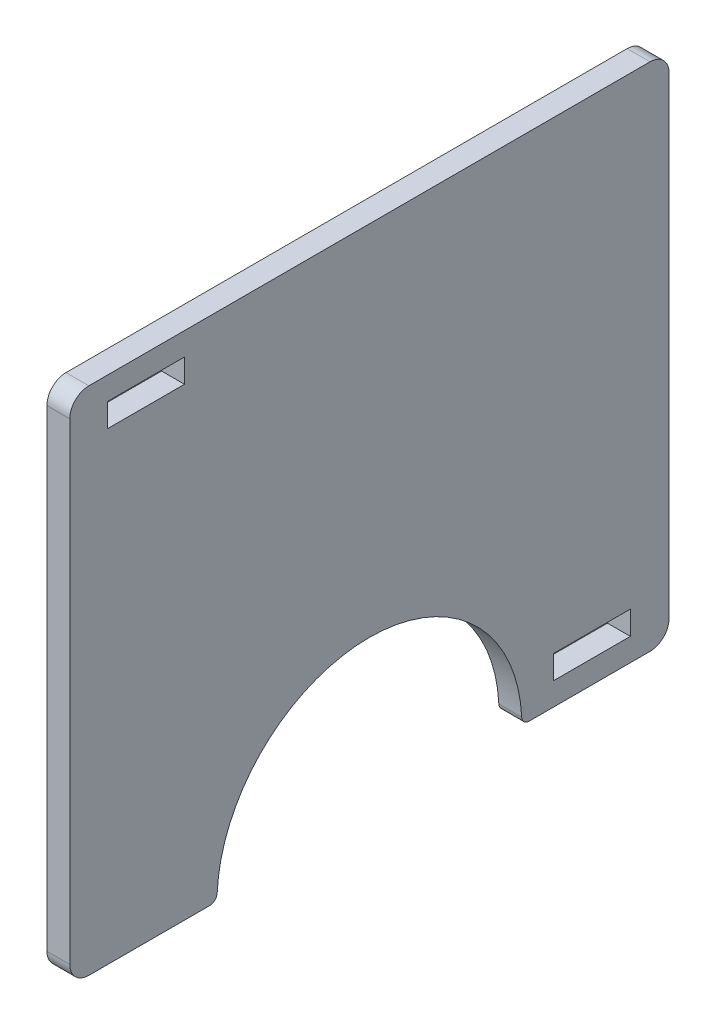
from build123d import *

# Parameters (mm, degrees)
SALIENTE_EXTRUIR1_DEPTH = 3
CROQUIS2_R              = 20
CROQUIS2_W              = 10.1
CROQUIS2_H              = 3.1
CORTAR_EXTRUIR1_DEPTH   = 3
REDONDEO1_R             = 1


with BuildPart() as part:
    # Croquis1 → Saliente-Extruir1 (new body)
    with BuildSketch(Plane(origin=(0, 0, 0), x_dir=(0, 0, -1), z_dir=(1, 0, 0))):
        with BuildLine():
            Line((-36.82, 33.5), (36.82, 33.5))
            ThreePointArc((36.82, 33.5), (38.587766953, 32.767766953), (39.32, 31))
            Line((39.32, 31), (39.32, -31))
            ThreePointArc((39.32, -31), (38.587766953, -32.767766953), (36.82, -33.5))
            Line((36.82, -33.5), (-36.82, -33.5))
            ThreePointArc((-36.82, -33.5), (-38.587766953, -32.767766953), (-39.32, -31))
            Line((-39.32, -31), (-39.32, 31))
            ThreePointArc((-39.32, 31), (-38.587766953, 32.767766953), (-36.82, 33.5))
        make_face()
    extrude(amount=SALIENTE_EXTRUIR1_DEPTH)

    # Croquis2 → Cortar-Extruir1 (cut, symmetric)
    with BuildSketch(Plane(origin=(3, 0, 0), x_dir=(0, 0, -1), z_dir=(1, 0, 0))):
        with Locations((0, -33.5)):
            Circle(CROQUIS2_R)
        with Locations((29.18492387, -28.95)):
            Rectangle(CROQUIS2_W, CROQUIS2_H)
        with Locations((-29.32, 28.95)):
            Rectangle(CROQUIS2_W, CROQUIS2_H)
    extrude(amount=CORTAR_EXTRUIR1_DEPTH, both=True, mode=Mode.SUBTRACT)

    # Redondeo1
    redondeo1_edges = [part.edges().sort_by_distance(p)[0] for p in [
        (1.5, -33.5, 20),
        (1.5, -33.5, -20),
    ]]
    fillet(redondeo1_edges, radius=REDONDEO1_R)


solid = part.part
